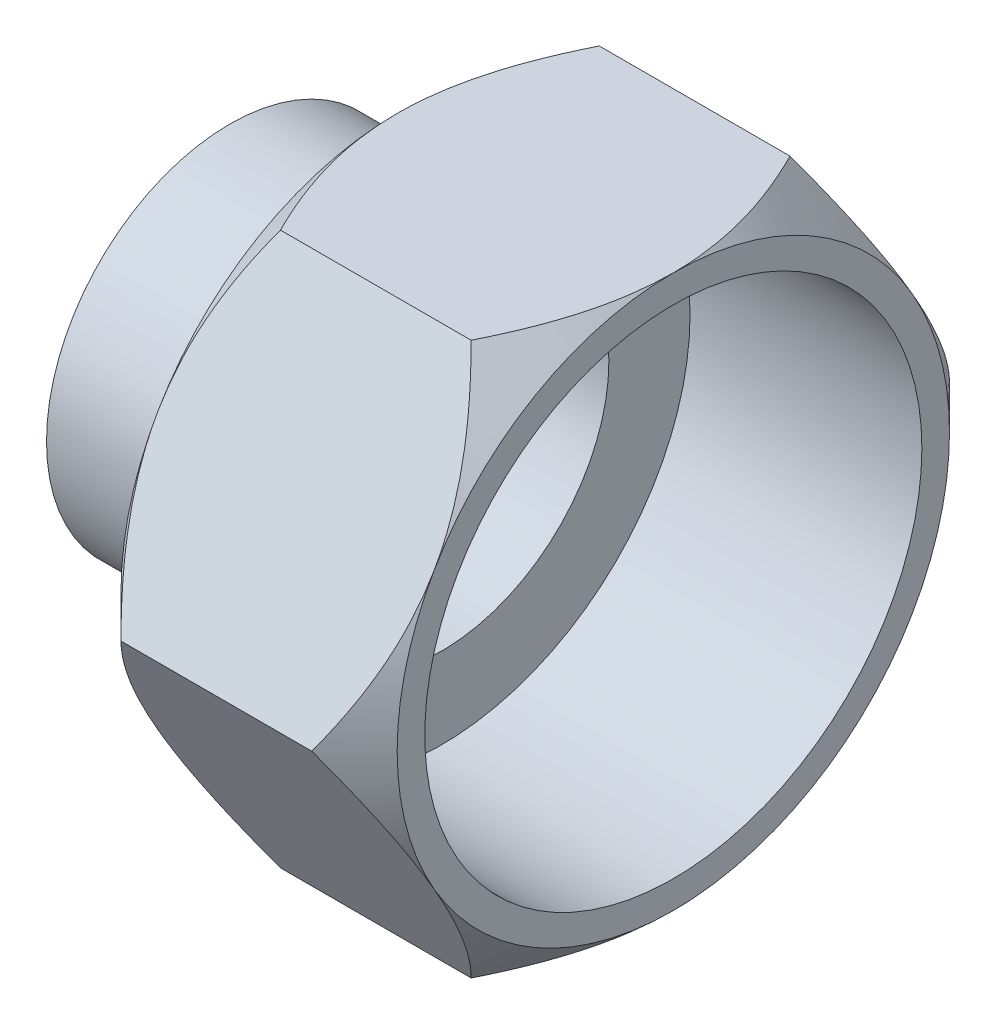
from build123d import *

# Parameters (mm, degrees)
SKETCH_1_R          = 21.9
SKETCH_1_R_2        = 20
EXTRUDE_1_DEPTH     = 20
EXTRUDE_2_DEPTH     = 33
SKETCH_8_OUTSIDE_W  = 120.99
SKETCH_8_OUTSIDE_H  = 110.78
SKETCH_8_OUTSIDE_R  = 33
CUT_EXTRUDE_4_DEPTH = 10
CUT_EXTRUDE_4_DRAFT = -45
SKETCH_9_OUTSIDE_W  = 120.99
SKETCH_9_OUTSIDE_H  = 110.78
SKETCH_9_OUTSIDE_R  = 33
CUT_EXTRUDE_5_DEPTH = 10
CUT_EXTRUDE_5_DRAFT = -45
SKETCH_10_R         = 29.7
CUT_EXTRUDE_6_DEPTH = 27.7
SKETCH_11_R         = 20
CUT_EXTRUDE_7_DEPTH = 58.517736395


with BuildPart() as part:
    # Эскиз1 → Вытянуть-Тонкостенный1 (new body)
    with BuildSketch(Plane(origin=(0, 0, 0), x_dir=(0, 0, -1), z_dir=(1, 0, 0))):
        Circle(SKETCH_1_R)
        Circle(SKETCH_1_R_2, mode=Mode.SUBTRACT)
    extrude(amount=EXTRUDE_1_DEPTH)

    # Эскиз2 → Бобышка-Вытянуть2 (add)
    with BuildSketch(Plane(origin=(20, 0, 0), x_dir=(0, 0, -1), z_dir=(1, 0, 0))):
        Polygon((38.105117767, 0), (19.052558883, 33), (-19.052558883, 33), (-38.105117767, 0), (-19.052558883, -33), (19.052558883, -33), align=None)
    extrude(amount=EXTRUDE_2_DEPTH)


with BuildPart() as cut_extrude_4_tool:
    # Эскиз8 outside → Вырез-Вытянуть4 (with draft: the straight prism first)
    with BuildSketch(Plane.ZY.offset(-20)):
        Rectangle(SKETCH_8_OUTSIDE_W, SKETCH_8_OUTSIDE_H)
        Circle(SKETCH_8_OUTSIDE_R, mode=Mode.SUBTRACT)
    extrude(amount=-CUT_EXTRUDE_4_DEPTH)
    # Вырез-Вытянуть4: the draft: its side faces are tilted about the plane it starts from
    cut_extrude_4_sides = [cut_extrude_4_tool.faces().sort_by_distance(p)[0] for p in [
        (25, -55.39, 0),
        (25, 0, 60.495),
        (25, 55.39, 0),
        (25, 0, -60.495),
        (25, 0, -33),
    ]]
    draft(cut_extrude_4_sides, Plane.ZY.offset(-20), CUT_EXTRUDE_4_DRAFT)


with BuildPart() as part_1:
    add(part.part)

    # Вырез-Вытянуть4: cut by cut_extrude_4_tool
    add(cut_extrude_4_tool.part, mode=Mode.SUBTRACT)


with BuildPart() as cut_extrude_5_tool:
    # Эскиз9 outside → Вырез-Вытянуть5 (with draft: the straight prism first)
    with BuildSketch(Plane(origin=(53, 0, 0), x_dir=(0, 0, -1), z_dir=(1, 0, 0))):
        Rectangle(SKETCH_9_OUTSIDE_W, SKETCH_9_OUTSIDE_H)
        Circle(SKETCH_9_OUTSIDE_R, mode=Mode.SUBTRACT)
    extrude(amount=-CUT_EXTRUDE_5_DEPTH)
    # Вырез-Вытянуть5: the draft: its side faces are tilted about the plane it starts from
    cut_extrude_5_sides = [cut_extrude_5_tool.faces().sort_by_distance(p)[0] for p in [
        (48, -55.39, 0),
        (48, 0, -60.495),
        (48, 55.39, 0),
        (48, 0, 60.495),
        (48, 0, 33),
    ]]
    draft(cut_extrude_5_sides, Plane(origin=(53, 0, 0), x_dir=(0, 0, -1), z_dir=(1, 0, 0)), CUT_EXTRUDE_5_DRAFT)


with BuildPart() as part_2:
    add(part_1.part)

    # Вырез-Вытянуть5: cut by cut_extrude_5_tool
    add(cut_extrude_5_tool.part, mode=Mode.SUBTRACT)

    # Эскиз10 → Вырез-Вытянуть6 (cut)
    with BuildSketch(Plane(origin=(53, 0, 0), x_dir=(0, 0, -1), z_dir=(1, 0, 0))):
        Circle(SKETCH_10_R)
    extrude(amount=-CUT_EXTRUDE_6_DEPTH, mode=Mode.SUBTRACT)

    # Эскиз11 → Вырез-Вытянуть7 (cut, through all)
    with BuildSketch(Plane(origin=(25.3, 0, 0), x_dir=(0, 0, -1), z_dir=(1, 0, 0))):
        Circle(SKETCH_11_R)
    extrude(amount=-CUT_EXTRUDE_7_DEPTH, mode=Mode.SUBTRACT)


solid = part_2.part
